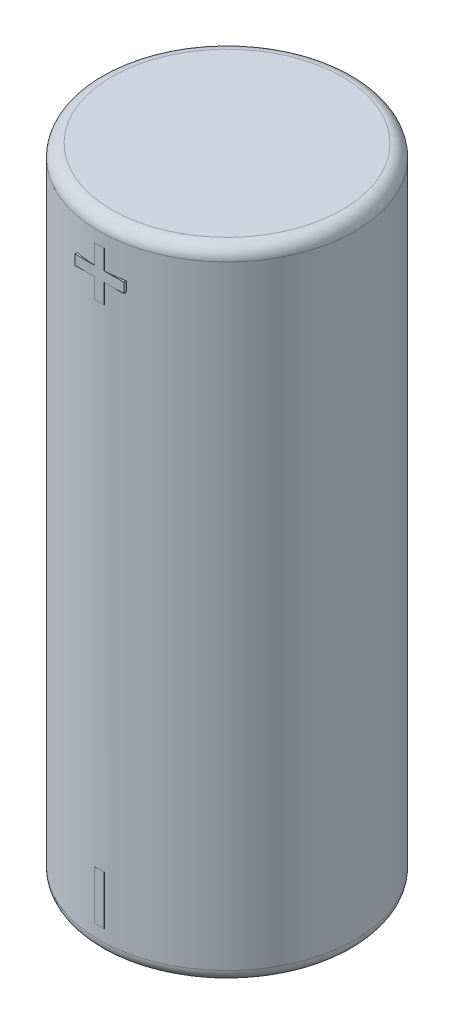
from build123d import *

# Parameters (mm, degrees)
SKETCH1_R           = 13
BOSS_EXTRUDE1_DEPTH = 65
FILLET1_R           = 1.27
FILLET2_R           = 1.27
SKETCH2_W           = 0.5
SKETCH2_H           = 5
SKETCH2_W_2         = 1
SKETCH2_W_3         = 5
SKETCH2_H_2         = 1
BOSS_EXTRUDE2_DEPTH = 10


with BuildPart() as part:
    # Sketch1 → Boss-Extrude1 (new body)
    with BuildSketch(Plane(origin=(0, 0, 0), x_dir=(1, 0, 0), z_dir=(0, 1, 0))):
        with Locations(Location((0, 0, 0), (0, 0, 270))):
            Circle(SKETCH1_R)
    extrude(amount=BOSS_EXTRUDE1_DEPTH)

    # Fillet1
    fillet1_edges = [part.edges().sort_by_distance(p)[0] for p in [
        (0, 65, -13),
    ]]
    fillet(fillet1_edges, radius=FILLET1_R)

    # Fillet2
    fillet2_edges = [part.edges().sort_by_distance(p)[0] for p in [
        (0, 0, -13),
    ]]
    fillet(fillet2_edges, radius=FILLET2_R)

    # Sketch2 → Boss-Extrude2 (add)
    with BuildSketch(Plane.XY.offset(13)):
        with Locations((-0.25, 5)):
            Rectangle(SKETCH2_W, SKETCH2_H)
        with Locations((0.25, 5)):
            Rectangle(SKETCH2_W, SKETCH2_H)
        with Locations((0, 60)):
            Rectangle(SKETCH2_W_2, SKETCH2_H)
        with Locations((0, 60)):
            Rectangle(SKETCH2_W_3, SKETCH2_H_2)
    extrude(amount=-BOSS_EXTRUDE2_DEPTH)


solid = part.part
